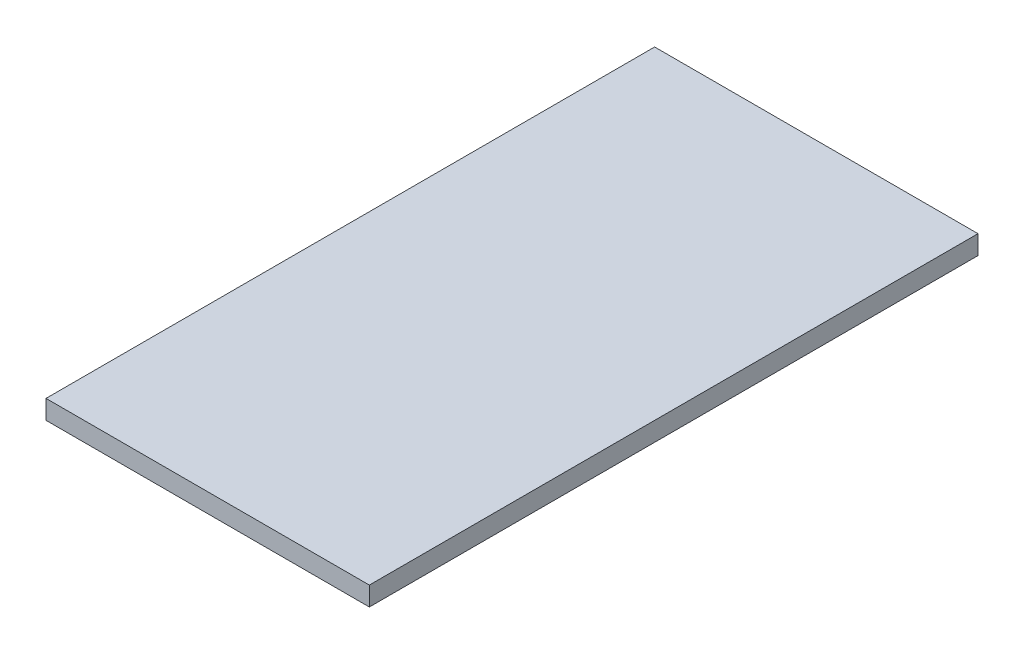
from build123d import *

# Parameters (mm, degrees)
SKETCH_1_W          = 17
SKETCH_1_H          = 33
EXTRUDE_1_DEPTH     = 10
CUT_EXTRUDE_START   = 1
SKETCH_2_W          = 15
SKETCH_2_H          = 32
CUT_EXTRUDE_1_DEPTH = 8
SKETCH_3_R          = 3
CUT_EXTRUDE_2_DEPTH = 22.083168642
CUT_EXTRUDE_START_2 = 9
SKETCH_5_W          = 17
SKETCH_5_H          = 32
CUT_EXTRUDE_3_DEPTH = 8
EXTRUDE_START       = 9
SKETCH_6_W          = 17
SKETCH_6_H          = 32
EXTRUDE_2_DEPTH     = 1
SKETCH_8_W          = 17
SKETCH_8_H          = 33
CUT_EXTRUDE_5_DEPTH = 9
SKETCH_9_W          = 17
SKETCH_9_H          = 1
CUT_EXTRUDE_6_DEPTH = 1


with BuildPart() as part:
    # 스케치1 → 보스-돌출1 (new body)
    with BuildSketch(Plane(origin=(0, 0, 0), x_dir=(1, 0, 0), z_dir=(0, 1, 0))):
        Rectangle(SKETCH_1_W, SKETCH_1_H)
    extrude(amount=EXTRUDE_1_DEPTH)

    # 스케치2 → 컷-돌출1 (cut)
    with BuildSketch(Plane(origin=(0, 0, 0), x_dir=(1, 0, 0), z_dir=(0, 1, 0)).offset(CUT_EXTRUDE_START)):
        with Locations((0, 0.5)):
            Rectangle(SKETCH_2_W, SKETCH_2_H)
    extrude(amount=CUT_EXTRUDE_1_DEPTH, mode=Mode.SUBTRACT)

    # 스케치3 → 컷-돌출2 (cut, through all)
    with BuildSketch(Plane.XY):
        with Locations(Location((0, 6, 0), (0, 0, 90))):
            Circle(SKETCH_3_R)
    extrude(amount=CUT_EXTRUDE_2_DEPTH, mode=Mode.SUBTRACT)

    # 스케치5 → 컷-돌출3 (cut)
    with BuildSketch(Plane(origin=(0, 0, 0), x_dir=(1, 0, 0), z_dir=(0, 1, 0)).offset(CUT_EXTRUDE_START_2)):
        with Locations((0, 0.5)):
            Rectangle(SKETCH_5_W, SKETCH_5_H)
    extrude(amount=CUT_EXTRUDE_3_DEPTH, mode=Mode.SUBTRACT)

    # 스케치8 → 컷-돌출5 (cut)
    with BuildSketch(Plane.XZ):
        Rectangle(SKETCH_8_W, SKETCH_8_H)
    extrude(amount=-CUT_EXTRUDE_5_DEPTH, mode=Mode.SUBTRACT)

    # 스케치9 → 컷-돌출6 (cut)
    with BuildSketch(Plane.XY.offset(16.5)):
        with Locations((0, 9.5)):
            Rectangle(SKETCH_9_W, SKETCH_9_H)
    extrude(amount=-CUT_EXTRUDE_6_DEPTH, mode=Mode.SUBTRACT)


with BuildPart() as body_2:
    # 스케치6 → 보스-돌출2 (new body)
    with BuildSketch(Plane(origin=(0, 0, 0), x_dir=(1, 0, 0), z_dir=(0, 1, 0)).offset(EXTRUDE_START)):
        with Locations((0, 0.5)):
            Rectangle(SKETCH_6_W, SKETCH_6_H)
    extrude(amount=EXTRUDE_2_DEPTH)


solid = body_2.part
